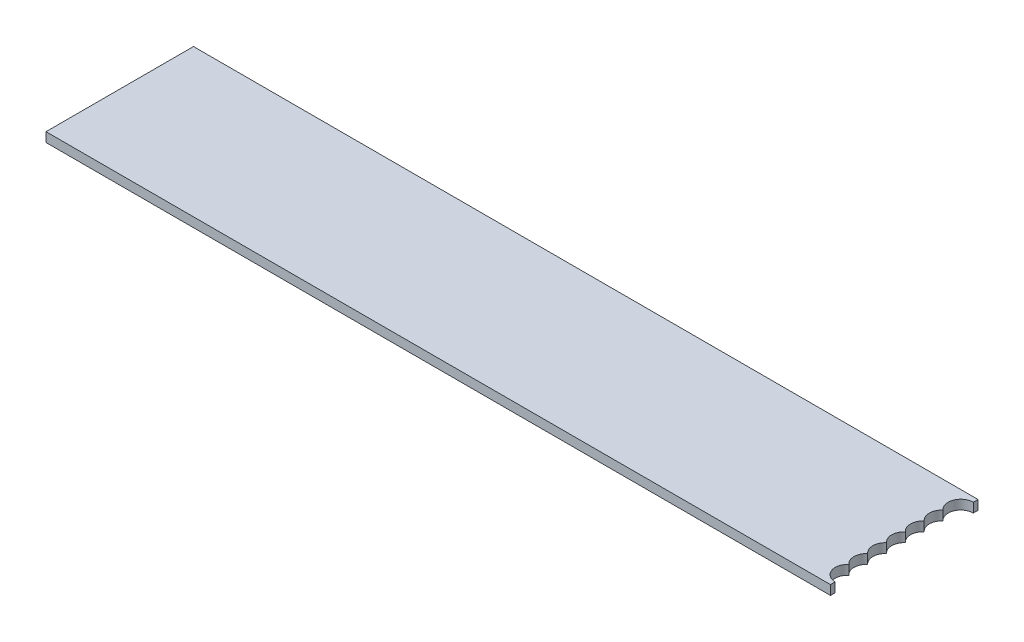
from build123d import *

# Parameters (mm, degrees)
SKETCH_1_W          = 125
SKETCH_1_H          = 23.5
EXTRUDE_1_DEPTH     = 1.5
CUT_EXTRUDE_1_DEPTH = 64.612597023


with BuildPart() as part:
    # Эскиз1 → Бобышка-Вытянуть1 (new body)
    with BuildSketch(Plane(origin=(0, 0, 0), x_dir=(1, 0, 0), z_dir=(0, 1, 0))):
        Rectangle(SKETCH_1_W, SKETCH_1_H)
    extrude(amount=EXTRUDE_1_DEPTH)

    # Эскиз2 → Вырез-Вытянуть1 (cut, through all)
    with BuildSketch(Plane(origin=(0, 1.5, 0), x_dir=(1, 0, 0), z_dir=(0, 1, 0))):
        with BuildLine():
            ThreePointArc((62.5, 11), (60.629171307, 9.707106781), (61.177124344, 7.5))
            ThreePointArc((61.177124344, 7.5), (61.792893219, 7.870828693), (62.5, 8))
            Line((62.5, 8), (62.5, 11))
        make_face()
        with BuildLine():
            ThreePointArc((62.5, 8), (61.792893219, 7.870828693), (61.177124344, 7.5))
            ThreePointArc((61.177124344, 7.5), (61.792893219, 7.129171307), (62.5, 7))
            Line((62.5, 7), (62.5, 8))
        make_face()
        with BuildLine():
            Line((62.5, 8), (62.5, 7))
            ThreePointArc((62.5, 7), (63.207106781, 7.129171307), (63.822875656, 7.5))
            ThreePointArc((63.822875656, 7.5), (63.207106781, 7.870828693), (62.5, 8))
        make_face()
        with BuildLine():
            ThreePointArc((62.5, 8), (63.207106781, 7.870828693), (63.822875656, 7.5))
            ThreePointArc((63.822875656, 7.5), (64.322875656, 8.177124344), (64.5, 9))
            ThreePointArc((64.5, 9), (63.914213562, 10.414213562), (62.5, 11))
            Line((62.5, 11), (62.5, 8))
        make_face()
        with BuildLine():
            ThreePointArc((62.5, 5), (63.207106781, 4.870828693), (63.822875656, 4.5))
            ThreePointArc((63.822875656, 4.5), (64.322875656, 5.177124344), (64.5, 6))
            ThreePointArc((64.5, 6), (64.322875656, 6.822875656), (63.822875656, 7.5))
            ThreePointArc((63.822875656, 7.5), (63.207106781, 7.129171307), (62.5, 7))
            Line((62.5, 7), (62.5, 5))
        make_face()
        with BuildLine():
            ThreePointArc((61.177124344, 7.5), (60.5, 6), (61.177124344, 4.5))
            ThreePointArc((61.177124344, 4.5), (61.792893219, 4.870828693), (62.5, 5))
            Line((62.5, 5), (62.5, 7))
            ThreePointArc((62.5, 7), (61.792893219, 7.129171307), (61.177124344, 7.5))
        make_face()
        with BuildLine():
            Line((62.5, 5), (62.5, 4))
            ThreePointArc((62.5, 4), (63.207106781, 4.129171307), (63.822875656, 4.5))
            ThreePointArc((63.822875656, 4.5), (63.207106781, 4.870828693), (62.5, 5))
        make_face()
        with BuildLine():
            ThreePointArc((61.177124344, 4.5), (61.792893219, 4.129171307), (62.5, 4))
            Line((62.5, 4), (62.5, 5))
            ThreePointArc((62.5, 5), (61.792893219, 4.870828693), (61.177124344, 4.5))
        make_face()
        with BuildLine():
            ThreePointArc((62.5, 2), (63.207106781, 1.870828693), (63.822875656, 1.5))
            ThreePointArc((63.822875656, 1.5), (64.322875656, 2.177124344), (64.5, 3))
            ThreePointArc((64.5, 3), (64.322875656, 3.822875656), (63.822875656, 4.5))
            ThreePointArc((63.822875656, 4.5), (63.207106781, 4.129171307), (62.5, 4))
            Line((62.5, 4), (62.5, 2))
        make_face()
        with BuildLine():
            ThreePointArc((61.177124344, 1.5), (61.792893219, 1.870828693), (62.5, 2))
            Line((62.5, 2), (62.5, 4))
            ThreePointArc((62.5, 4), (61.792893219, 4.129171307), (61.177124344, 4.5))
            ThreePointArc((61.177124344, 4.5), (60.5, 3), (61.177124344, 1.5))
        make_face()
        with BuildLine():
            ThreePointArc((62.5, 1), (63.207106781, 1.129171307), (63.822875656, 1.5))
            ThreePointArc((63.822875656, 1.5), (63.207106781, 1.870828693), (62.5, 2))
            Line((62.5, 2), (62.5, 1))
        make_face()
        with BuildLine():
            Line((62.5, 1), (62.5, 2))
            ThreePointArc((62.5, 2), (61.792893219, 1.870828693), (61.177124344, 1.5))
            ThreePointArc((61.177124344, 1.5), (61.792893219, 1.129171307), (62.5, 1))
        make_face()
        with BuildLine():
            ThreePointArc((63.822875656, -1.5), (64.322875656, -0.822875656), (64.5, 0))
            ThreePointArc((64.5, 0), (64.322875656, 0.822875656), (63.822875656, 1.5))
            ThreePointArc((63.822875656, 1.5), (63.207106781, 1.129171307), (62.5, 1))
            Line((62.5, 1), (62.5, -1))
            ThreePointArc((62.5, -1), (63.207106781, -1.129171307), (63.822875656, -1.5))
        make_face()
        with BuildLine():
            Line((62.5, -1), (62.5, 1))
            ThreePointArc((62.5, 1), (61.792893219, 1.129171307), (61.177124344, 1.5))
            ThreePointArc((61.177124344, 1.5), (60.5, 0), (61.177124344, -1.5))
            ThreePointArc((61.177124344, -1.5), (61.792893219, -1.129171307), (62.5, -1))
        make_face()
        with BuildLine():
            ThreePointArc((62.5, -2), (63.207106781, -1.870828693), (63.822875656, -1.5))
            ThreePointArc((63.822875656, -1.5), (63.207106781, -1.129171307), (62.5, -1))
            Line((62.5, -1), (62.5, -2))
        make_face()
        with BuildLine():
            ThreePointArc((61.177124344, -1.5), (61.792893219, -1.870828693), (62.5, -2))
            Line((62.5, -2), (62.5, -1))
            ThreePointArc((62.5, -1), (61.792893219, -1.129171307), (61.177124344, -1.5))
        make_face()
        with BuildLine():
            ThreePointArc((64.5, -3), (64.322875656, -2.177124344), (63.822875656, -1.5))
            ThreePointArc((63.822875656, -1.5), (63.207106781, -1.870828693), (62.5, -2))
            Line((62.5, -2), (62.5, -4))
            ThreePointArc((62.5, -4), (63.207106781, -4.129171307), (63.822875656, -4.5))
            ThreePointArc((63.822875656, -4.5), (64.322875656, -3.822875656), (64.5, -3))
        make_face()
        with BuildLine():
            Line((62.5, -4), (62.5, -2))
            ThreePointArc((62.5, -2), (61.792893219, -1.870828693), (61.177124344, -1.5))
            ThreePointArc((61.177124344, -1.5), (60.5, -3), (61.177124344, -4.5))
            ThreePointArc((61.177124344, -4.5), (61.792893219, -4.129171307), (62.5, -4))
        make_face()
        with BuildLine():
            Line((62.5, -5), (62.5, -4))
            ThreePointArc((62.5, -4), (61.792893219, -4.129171307), (61.177124344, -4.5))
            ThreePointArc((61.177124344, -4.5), (61.792893219, -4.870828693), (62.5, -5))
        make_face()
        with BuildLine():
            ThreePointArc((63.822875656, -4.5), (63.207106781, -4.129171307), (62.5, -4))
            Line((62.5, -4), (62.5, -5))
            ThreePointArc((62.5, -5), (63.207106781, -4.870828693), (63.822875656, -4.5))
        make_face()
        with BuildLine():
            ThreePointArc((64.5, -6), (64.322875656, -5.177124344), (63.822875656, -4.5))
            ThreePointArc((63.822875656, -4.5), (63.207106781, -4.870828693), (62.5, -5))
            Line((62.5, -5), (62.5, -7))
            ThreePointArc((62.5, -7), (63.207106781, -7.129171307), (63.822875656, -7.5))
            ThreePointArc((63.822875656, -7.5), (64.322875656, -6.822875656), (64.5, -6))
        make_face()
        with BuildLine():
            ThreePointArc((62.5, -5), (61.792893219, -4.870828693), (61.177124344, -4.5))
            ThreePointArc((61.177124344, -4.5), (60.5, -6), (61.177124344, -7.5))
            ThreePointArc((61.177124344, -7.5), (61.792893219, -7.129171307), (62.5, -7))
            Line((62.5, -7), (62.5, -5))
        make_face()
        with BuildLine():
            ThreePointArc((62.5, -7), (61.792893219, -7.129171307), (61.177124344, -7.5))
            ThreePointArc((61.177124344, -7.5), (61.792893219, -7.870828693), (62.5, -8))
            Line((62.5, -8), (62.5, -7))
        make_face()
        with BuildLine():
            ThreePointArc((62.5, -8), (61.792893219, -7.870828693), (61.177124344, -7.5))
            ThreePointArc((61.177124344, -7.5), (60.629171307, -9.707106781), (62.5, -11))
            Line((62.5, -11), (62.5, -8))
        make_face()
        with BuildLine():
            ThreePointArc((63.822875656, -7.5), (63.207106781, -7.129171307), (62.5, -7))
            Line((62.5, -7), (62.5, -8))
            ThreePointArc((62.5, -8), (63.207106781, -7.870828693), (63.822875656, -7.5))
        make_face()
        with BuildLine():
            ThreePointArc((64.5, -9), (64.322875656, -8.177124344), (63.822875656, -7.5))
            ThreePointArc((63.822875656, -7.5), (63.207106781, -7.870828693), (62.5, -8))
            Line((62.5, -8), (62.5, -11))
            ThreePointArc((62.5, -11), (63.914213562, -10.414213562), (64.5, -9))
        make_face()
    extrude(amount=-CUT_EXTRUDE_1_DEPTH, mode=Mode.SUBTRACT)


solid = part.part
